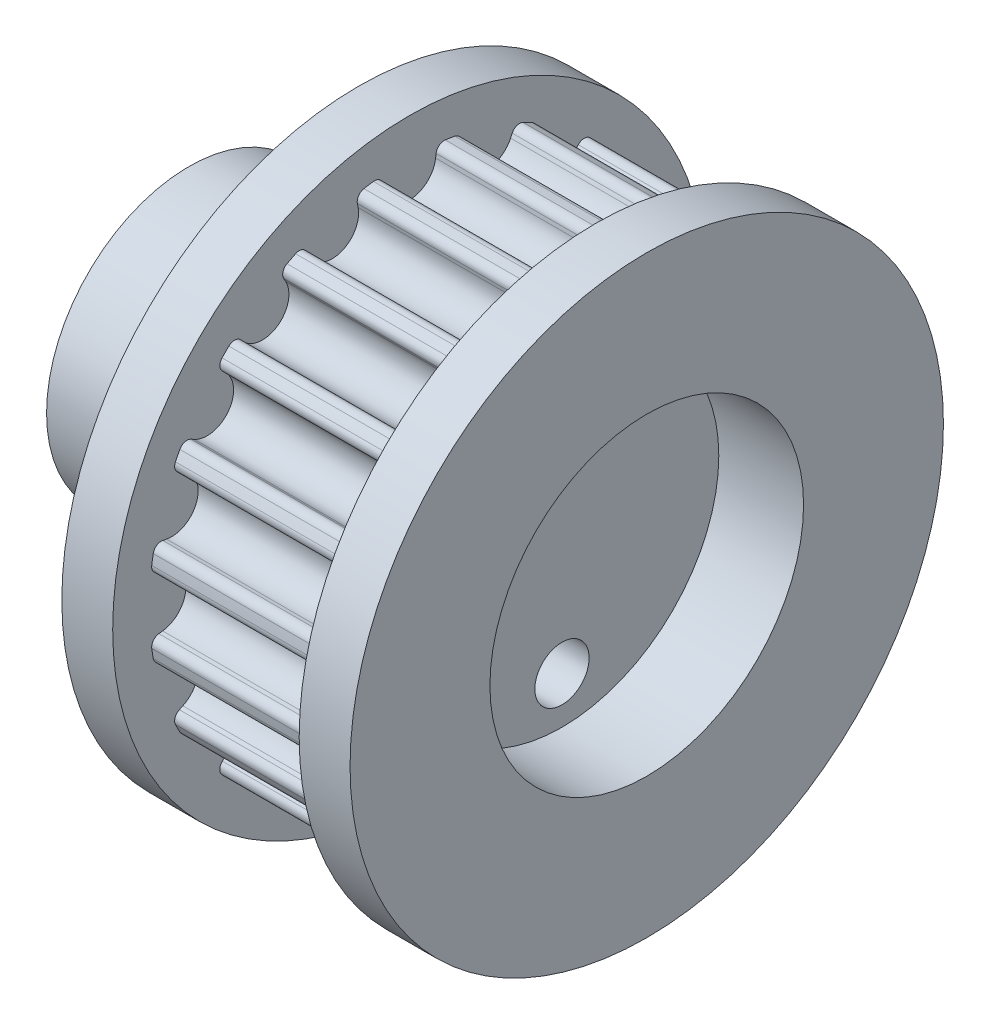
from build123d import *

# Parameters (mm, degrees)
CHAMFER_1_SIZE           = 1
SKETCH_4_W               = 2
SKETCH_4_H               = 1
CUT_EXTRUDE_1_DEPTH      = 36.4233722
CUT_EXTRUDE_2_REACH      = 37.423
PATTERN_CIRCULAR_3_COUNT = 20
SKETCH_8_R               = 17.530868232
CUT_EXTRUDE_3_DEPTH      = 17
SKETCH_9_R               = 7.01145328
EXTRUDE_1_DEPTH          = 11
SKETCH_10_R              = 17.5
EXTRUDE_2_DEPTH          = 3
EXTRUDE_START            = 3
SKETCH_11_R              = 17.5
EXTRUDE_3_DEPTH          = 3
SKETCH_12_R              = 9.25
CUT_EXTRUDE_4_DEPTH      = 5
SKETCH_13_R              = 1.6
CUT_EXTRUDE_5_DEPTH      = 28.504545079
SKETCH_14_R              = 12
SKETCH_14_R_2            = 3.5
SKETCH_14_R_3            = 1.6
EXTRUDE_4_DEPTH          = 3
SKETCH_17_R              = 8.4
EXTRUDE_6_DEPTH          = 7
SKETCH_18_R              = 1.6
CUT_EXTRUDE_7_DEPTH      = 34.11344138


with BuildPart() as part:
    # 草图1 → 旋转1 (revolve)
    with BuildSketch(Plane.XY, mode=Mode.PRIVATE) as revolve_1_sk:
        Polygon((0, 3.0686), (0, 15.343), (28, 15.343), (28, 6.1372), (20, 6.1372), (20, 3.0686), align=None)
    revolve(revolve_1_sk.sketch.rotate(Axis((0, 0, 0), (1, 0, 0)), 90), axis=Axis((0, 0, 0), (1, 0, 0)))

    # 倒角1
    chamfer_1_edges = [part.edges().sort_by_distance(p)[0] for p in [
        (20, 0, -3.0686),
        (0, 0, -3.0686),
    ]]
    chamfer(chamfer_1_edges, length=CHAMFER_1_SIZE)

    # 草图4 → 切除-拉伸1 (cut, through all)
    with BuildSketch(Plane.ZY):
        with Locations((0, 3.401087031)):
            Rectangle(SKETCH_4_W, SKETCH_4_H)
    extrude(amount=-CUT_EXTRUDE_1_DEPTH, mode=Mode.SUBTRACT)

    # 草图6 → 切除-拉伸2 (cut, up to next)
    with BuildSketch(Plane(origin=(0, 0, 0), x_dir=(0, 0, -1), z_dir=(1, 0, 0)), mode=Mode.PRIVATE) as cut_extrude_2_sk1:
        with BuildLine():
            Line((1.576146133, 14.779086011), (1.548371997, 14.552883824))
            ThreePointArc((1.548371997, 14.552883824), (0, 13.183), (-1.548371997, 14.552883824))
            Line((-1.548371997, 14.552883824), (-1.576146133, 14.779086011))
            ThreePointArc((-1.576146133, 14.779086011), (-1.760156371, 15.101239842), (-2.118855897, 15.195989559))
            ThreePointArc((-2.118855897, 15.195989559), (-2.356297075, 15.160986547), (-2.593161675, 15.122273689))
            Line((-2.593161675, 15.122273689), (-6.402553611, 46.147281297))
            ThreePointArc((-6.402553611, 46.147281297), (0, 46.589314911), (6.402553611, 46.147281297))
            Line((6.402553611, 46.147281297), (2.593161675, 15.122273689))
            ThreePointArc((2.593161675, 15.122273689), (2.356297075, 15.160986547), (2.118855897, 15.195989559))
            ThreePointArc((2.118855897, 15.195989559), (1.760156371, 15.101239842), (1.576146133, 14.779086011))
        make_face()
    cut_extrude_2_tool1 = extrude(cut_extrude_2_sk1.sketch, amount=CUT_EXTRUDE_2_REACH, mode=Mode.PRIVATE) & part.part
    cut_extrude_2 = cut_extrude_2_tool1.solids().sort_by_distance((0, 32.67982, 0))[0]
    add(cut_extrude_2, mode=Mode.SUBTRACT)

    # 阵列(圆周)3: 切除-拉伸2 ×20 about axis
    pattern_circular_3_axis = Axis((0, 0, 0), (1, 0, 0))
    for i in range(1, PATTERN_CIRCULAR_3_COUNT):
        add(cut_extrude_2.rotate(pattern_circular_3_axis, i * 360 / PATTERN_CIRCULAR_3_COUNT), mode=Mode.SUBTRACT)

    # 草图8 → 切除-拉伸3 (cut)
    with BuildSketch(Plane(origin=(28, 0, 0), x_dir=(0, 0, -1), z_dir=(1, 0, 0))):
        Circle(SKETCH_8_R)
    extrude(amount=-CUT_EXTRUDE_3_DEPTH, mode=Mode.SUBTRACT)

    # 草图9 → 凸台-拉伸1 (add)
    with BuildSketch(Plane(origin=(11, 0, 0), x_dir=(0, 0, -1), z_dir=(1, 0, 0))):
        Circle(SKETCH_9_R)
    extrude(amount=-EXTRUDE_1_DEPTH)

    # 草图10 → 凸台-拉伸2 (add)
    with BuildSketch(Plane(origin=(11, 0, 0), x_dir=(0, 0, -1), z_dir=(1, 0, 0))):
        Circle(SKETCH_10_R)
    extrude(amount=EXTRUDE_2_DEPTH)

    # 草图11 → 凸台-拉伸3 (add)
    with BuildSketch(Plane.ZY.offset(EXTRUDE_START)):
        with Locations(Location((0, 0, 0), (0, 0, 180))):
            Circle(SKETCH_11_R)
    extrude(amount=-EXTRUDE_3_DEPTH)

    # 草图12 → 切除-拉伸4 (cut)
    with BuildSketch(Plane(origin=(14, 0, 0), x_dir=(0, 0, -1), z_dir=(1, 0, 0))):
        Circle(SKETCH_12_R)
    extrude(amount=-CUT_EXTRUDE_4_DEPTH, mode=Mode.SUBTRACT)

    # 草图13 → 切除-拉伸5 (cut, through all)
    with BuildSketch(Plane(origin=(9, 0, 0), x_dir=(0, 0, -1), z_dir=(1, 0, 0))):
        with Locations((0, 6.5)):
            Circle(SKETCH_13_R)
        with Locations((0, -6.5)):
            Circle(SKETCH_13_R)
    extrude(amount=-CUT_EXTRUDE_5_DEPTH, mode=Mode.SUBTRACT)

    # 草图14 → 凸台-拉伸4 (add)
    # profile 1 of 3: a face of its own
    with BuildSketch(Plane.ZY.offset(3)):
        Circle(SKETCH_14_R)
        with Locations((0, -6.5)):
            Circle(SKETCH_14_R_2, mode=Mode.SUBTRACT)
        with Locations((0, 6.5)):
            Circle(SKETCH_14_R_2, mode=Mode.SUBTRACT)
    # profile 2 of 3: a face of its own
    with BuildSketch(Plane.ZY.offset(3)):
        with Locations((0, 6.5)):
            Circle(SKETCH_14_R_2)
        with Locations(Location((0, 6.5, 0), (0, 0, 180))):
            Circle(SKETCH_14_R_3, mode=Mode.SUBTRACT)
    # profile 3 of 3: a face of its own
    with BuildSketch(Plane.ZY.offset(3)):
        with Locations((0, -6.5)):
            Circle(SKETCH_14_R_2)
        with Locations(Location((0, -6.5, 0), (0, 0, 180))):
            Circle(SKETCH_14_R_3, mode=Mode.SUBTRACT)
    extrude(amount=EXTRUDE_4_DEPTH)

    # 草图17 → 凸台-拉伸6 (add)
    with BuildSketch(Plane.ZY.offset(6)):
        Circle(SKETCH_17_R)
    extrude(amount=EXTRUDE_6_DEPTH)

    # 草图18 → 切除-拉伸7 (cut, through all)
    with BuildSketch(Plane(origin=(9, 0, 0), x_dir=(0, 0, -1), z_dir=(1, 0, 0))):
        with Locations((0, 6.5)):
            Circle(SKETCH_18_R)
        with Locations((0, -6.5)):
            Circle(SKETCH_18_R)
    extrude(amount=-CUT_EXTRUDE_7_DEPTH, mode=Mode.SUBTRACT)


solid = part.part
